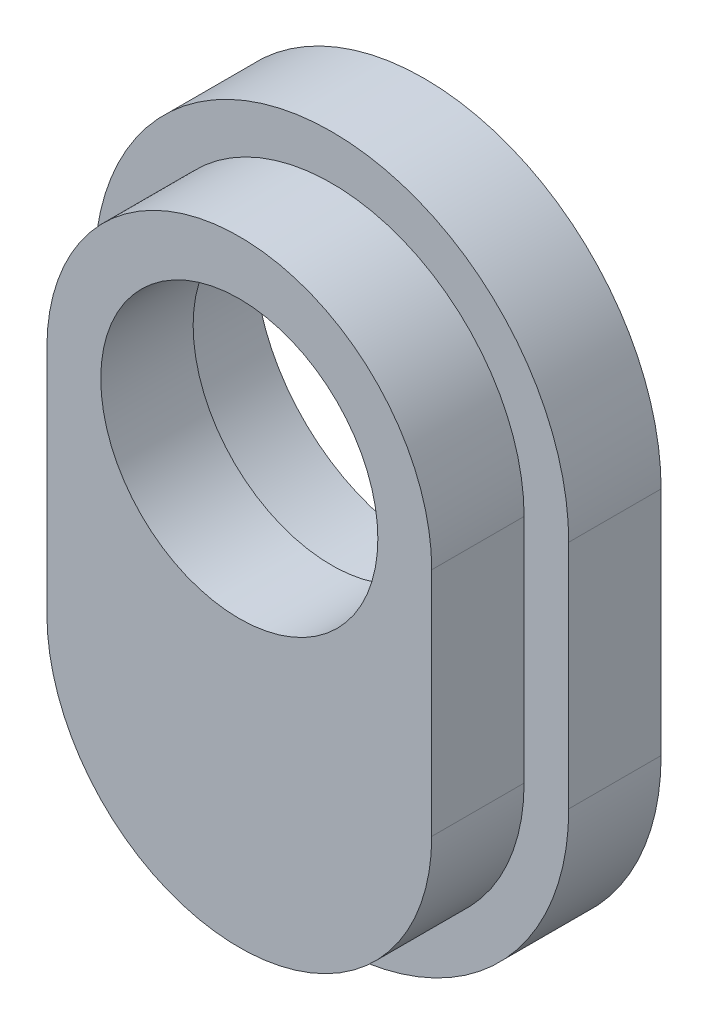
from build123d import *

# Parameters (mm, degrees)
SKETCH1_R           = 4.5
BOSS_EXTRUDE1_DEPTH = 6
SKETCH3_R           = 5.5
BOSS_EXTRUDE2_DEPTH = 3
SKETCH4_R           = 5.5
CUT_EXTRUDE1_DEPTH  = 3


with BuildPart() as part:
    # Sketch1 → Boss-Extrude1 (new body)
    with BuildSketch(Plane.XY):
        with BuildLine():
            Line((6.25, 0), (6.25, -7.5))
            ThreePointArc((6.25, -7.5), (0, -13.75), (-6.25, -7.5))
            Line((-6.25, -7.5), (-6.25, 0))
            ThreePointArc((-6.25, 0), (0, 6.25), (6.25, 0))
        make_face()
        Circle(SKETCH1_R, mode=Mode.SUBTRACT)
    extrude(amount=BOSS_EXTRUDE1_DEPTH)

    # Sketch3 → Boss-Extrude2 (add)
    with BuildSketch(Plane(origin=(0, 0, 0), x_dir=(-1, 0, 0), z_dir=(0, 0, -1))):
        with BuildLine():
            Line((7.7, 0), (7.7, -7.5))
            ThreePointArc((7.7, -7.5), (0, -15.2), (-7.7, -7.5))
            Line((-7.7, -7.5), (-7.7, 0))
            ThreePointArc((-7.7, 0), (0, 7.7), (7.7, 0))
        make_face()
        Circle(SKETCH3_R, mode=Mode.SUBTRACT)
    extrude(amount=-BOSS_EXTRUDE2_DEPTH)

    # Sketch4 → Cut-Extrude1 (cut)
    with BuildSketch(Plane(origin=(0, 0, 0), x_dir=(-1, 0, 0), z_dir=(0, 0, -1))):
        Circle(SKETCH4_R)
    extrude(amount=-CUT_EXTRUDE1_DEPTH, mode=Mode.SUBTRACT)


solid = part.part
